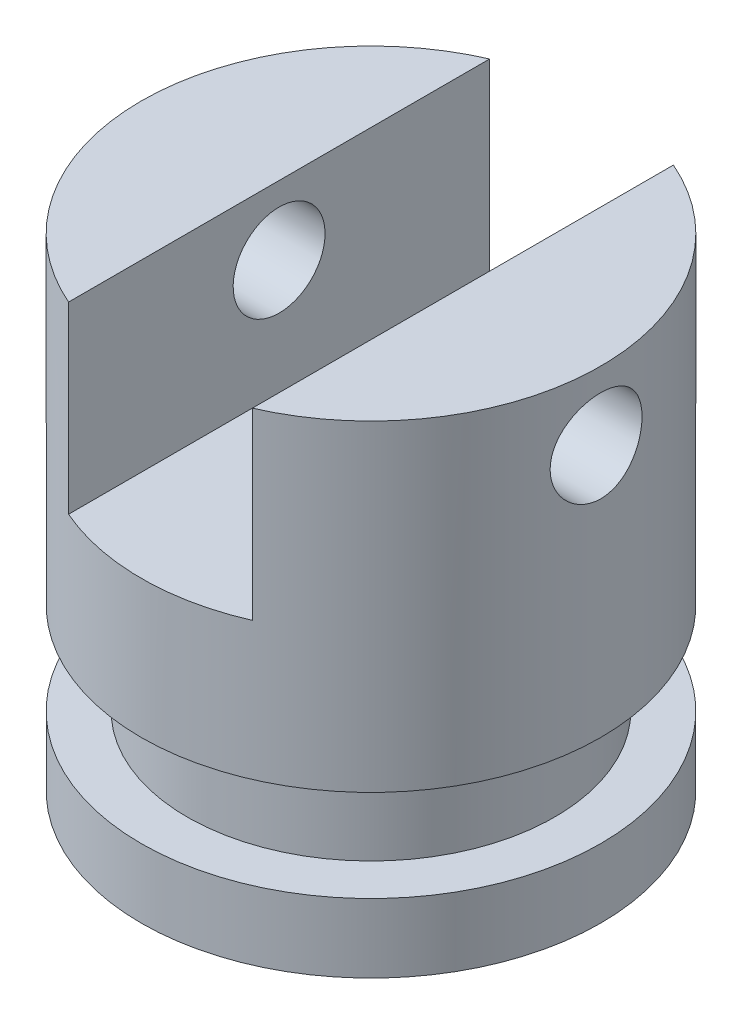
from build123d import *

# Parameters (mm, degrees)
CUT_EXTRUDE1_DEPTH    = 4
F_2_0MM_DOWEL_HOLE1_D = 2


with BuildPart() as part:
    # Sketch2 → Revolve1 (revolve)
    with BuildSketch(Plane.XY, mode=Mode.PRIVATE) as revolve1_sk:
        Polygon((0, 0), (5, 0), (5, 1.5), (4, 1.5), (4, 3.5), (5, 3.5), (5, 10.5), (0, 10.5), align=None)
    revolve(revolve1_sk.sketch.rotate(Axis((0, 10.5, 0), (0, -1, 0)), 180), axis=Axis((0, 10.5, 0), (0, -1, 0)))

    # Sketch3 → Cut-Extrude1 (cut)
    with BuildSketch(Plane(origin=(0, 10.5, 0), x_dir=(1, 0, 0), z_dir=(0, 1, 0))):
        with BuildLine():
            Line((-2, 4.582575695), (-2, -4.582575695))
            ThreePointArc((-2, -4.582575695), (0, -5), (2, -4.582575695))
            Line((2, -4.582575695), (2, 4.582575695))
            ThreePointArc((2, 4.582575695), (0, 5), (-2, 4.582575695))
        make_face()
    extrude(amount=-CUT_EXTRUDE1_DEPTH, mode=Mode.SUBTRACT)

    # Ø2.0mm Dowel Hole1 (through all)
    with Locations(Plane(origin=(5, 0, 0), x_dir=(0, 0, -1), z_dir=(1, 0, 0))):
        with Locations((0, 9)):
            Hole(F_2_0MM_DOWEL_HOLE1_D / 2)


solid = part.part
